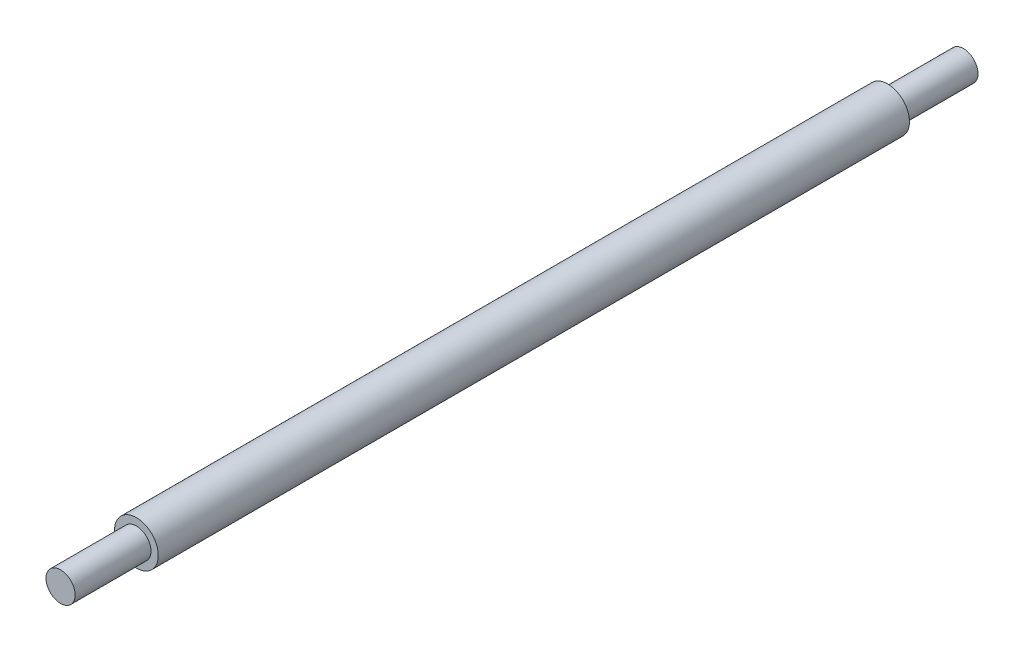
from build123d import *

# Parameters (mm, degrees)
SKETCH1_R           = 9.525
BOSS_EXTRUDE1_DEPTH = 327.025
SKETCH2_R           = 6.35
BOSS_EXTRUDE2_DEPTH = 33.02
BOSS_EXTRUDE3_START = 33.02
SKETCH3_R           = 6.35
BOSS_EXTRUDE3_DEPTH = 33.02


with BuildPart() as part:
    # Sketch1 → Boss-Extrude1 (new body)
    with BuildSketch(Plane.XY):
        with Locations(Location((0, 0, 0), (0, 0, 180))):
            Circle(SKETCH1_R)
    extrude(amount=BOSS_EXTRUDE1_DEPTH)

    # Sketch2 → Boss-Extrude2 (add)
    with BuildSketch(Plane.XY.offset(327.025)):
        Circle(SKETCH2_R)
    extrude(amount=BOSS_EXTRUDE2_DEPTH)

    # Sketch3 → Boss-Extrude3 (add)
    with BuildSketch(Plane(origin=(0, 0, 0), x_dir=(-1, 0, 0), z_dir=(0, 0, -1)).offset(BOSS_EXTRUDE3_START)):
        with Locations(Location((0, 0, 0), (0, 0, 180))):
            Circle(SKETCH3_R)
    extrude(amount=-BOSS_EXTRUDE3_DEPTH)


solid = part.part
